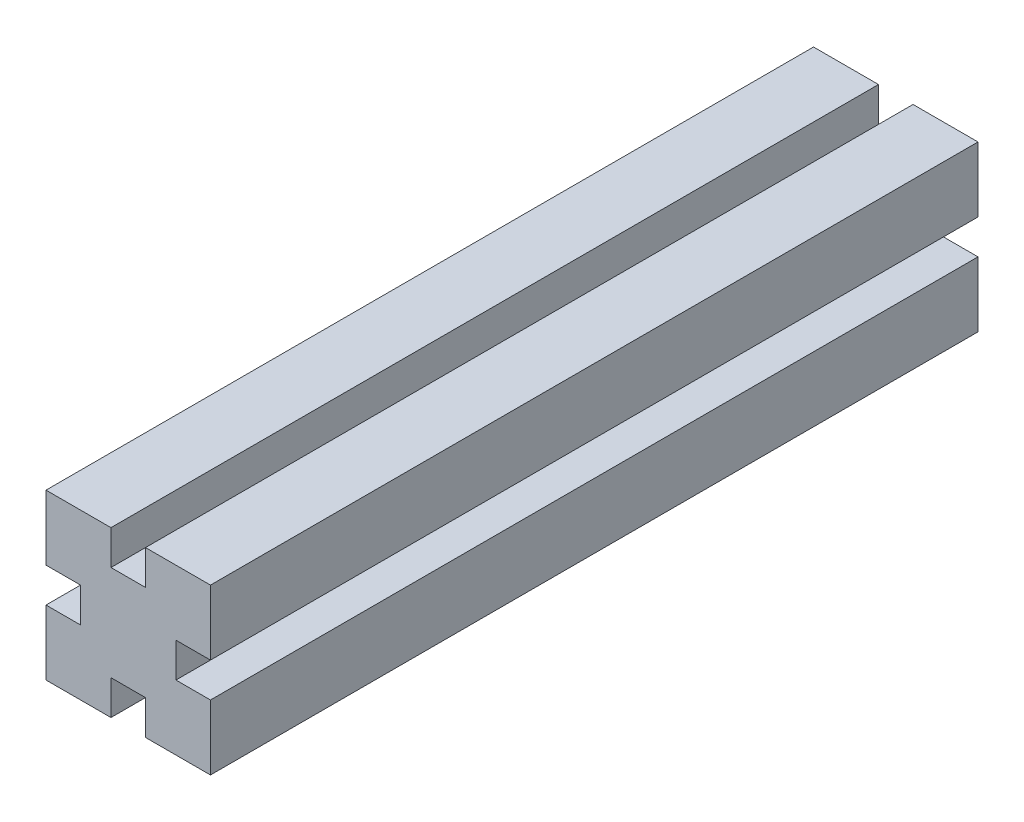
from build123d import *

# Parameters (mm, degrees)
PROFILE_DEPTH = 177.8


with BuildPart() as part:
    # Sketch1 → Profile (new body)
    with BuildSketch(Plane.XY):
        Polygon((-19.05, -19.05), (-4, -19.05), (-4, -11.05), (4, -11.05), (4, -19.05), (19.05, -19.05), (19.05, -4), (11.05, -4), (11.05, 4), (19.05, 4), (19.05, 19.05), (4, 19.05), (4, 11.05), (-4, 11.05), (-4, 19.05), (-19.05, 19.05), (-19.05, 4), (-11.05, 4), (-11.05, -4), (-19.05, -4), align=None)
    extrude(amount=PROFILE_DEPTH)


solid = part.part
